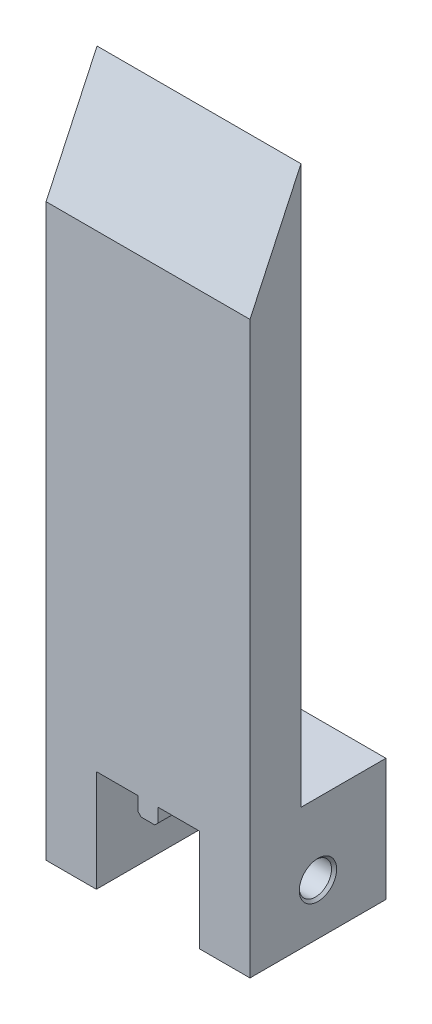
from build123d import *

# Parameters (mm, degrees)
SKETCH_1_W                   = 30
SKETCH_1_H                   = 170
EXTRUDE_1_DEPTH              = 40
CUT_EXTRUDE_1_DEPTH          = 99.615414617
SKETCH_4_W                   = 25
SKETCH_4_H                   = 164
CUT_EXTRUDE_2_DEPTH          = 99.615414617
HOLE_WIZARD_M5_2_D           = 5.5
HOLE_WIZARD_M5_2_CBORE_D     = 11
HOLE_WIZARD_M5_2_CBORE_DEPTH = 3
SKETCH_9_W                   = 6
SKETCH_9_H                   = 15
EXTRUDE_2_DEPTH              = 5
CHAMFER_1_SIZE               = 1
EXTRUDE_3_DEPTH              = 15
SKETCH_11_W                  = 14.8
SKETCH_11_H                  = 40
EXTRUDE_4_DEPTH              = 30


with BuildPart() as part:
    # 스케치1 → 보스-돌출1 (new body)
    with BuildSketch(Plane.XY):
        Rectangle(SKETCH_1_W, SKETCH_1_H)
    extrude(amount=EXTRUDE_1_DEPTH)

    # 스케치3 → 컷-돌출1 (cut, through all)
    with BuildSketch(Plane(origin=(15, 0, 0), x_dir=(0, 0, -1), z_dir=(1, 0, 0))):
        Polygon((-40, 85), (-40, 52.832396192), (-25, 85), align=None)
    extrude(amount=-CUT_EXTRUDE_1_DEPTH, mode=Mode.SUBTRACT)

    # 스케치4 → 컷-돌출2 (cut, through all)
    with BuildSketch(Plane.ZY.offset(15)):
        with Locations((12.5, 3)):
            Rectangle(SKETCH_4_W, SKETCH_4_H)
    extrude(amount=-CUT_EXTRUDE_2_DEPTH, mode=Mode.SUBTRACT)

    # M5 소켓 머리 캡 나사용 카운터보어2 (through all)
    with Locations(Plane(origin=(0, -79, 0), x_dir=(1, 0, 0), z_dir=(0, 1, 0))):
        with Locations((0, -10)):
            CounterBoreHole(HOLE_WIZARD_M5_2_D / 2, HOLE_WIZARD_M5_2_CBORE_D / 2, HOLE_WIZARD_M5_2_CBORE_DEPTH)

    # 스케치9 → 보스-돌출2 (add)
    with BuildSketch(Plane.XZ.offset(85)):
        with Locations((0, 32.5)):
            Rectangle(SKETCH_9_W, SKETCH_9_H)
    extrude(amount=EXTRUDE_2_DEPTH)

    # 모따기1
    chamfer_1_edges = [part.edges().sort_by_distance(p)[0] for p in [
        (3, -90, 32.5),
        (-3, -90, 32.5),
    ]]
    chamfer(chamfer_1_edges, length=CHAMFER_1_SIZE)

    # 스케치10 → 보스-돌출3 (add)
    with BuildSketch(Plane.ZY.offset(15)):
        Polygon((25, -79), (0, -79), (0, -85), (40, -85), (40, 52.832396192), (25, 85), align=None)
    extrude_3 = extrude(amount=EXTRUDE_3_DEPTH)

    # 대칭 복사1: 보스-돌출3 across plane
    add(extrude_3.mirror(Plane.ZY))

    # 스케치11 → 보스-돌출4 (add)
    with BuildSketch(Plane.XZ.offset(85)):
        with Locations((-22.6, 20)):
            Rectangle(SKETCH_11_W, SKETCH_11_H)
        with Locations((22.6, 20)):
            Rectangle(SKETCH_11_W, SKETCH_11_H)
    extrude(amount=EXTRUDE_4_DEPTH)

    # 스케치14 → M5 소켓 머리 캡 나사용 카운터보어1 (revolve, cut)
    with BuildSketch(Plane(origin=(30, -100, 20), x_dir=(0, 0, -1), z_dir=(0, 1, 0))):
        Polygon((0, 0), (0, 14.8), (2.75, 14.8), (2.75, 12), (4.75, 12), (4.75, 0.75), (5.5, 0), align=None)
    hole_wizard_m5_1 = revolve(axis=Axis((36.35, -100, 20), (-1, 0, 0)), mode=Mode.SUBTRACT)

    # 대칭 복사2: M5 소켓 머리 캡 나사용 카운터보어1 across plane
    add(hole_wizard_m5_1.mirror(Plane.ZY), mode=Mode.SUBTRACT)


solid = part.part
